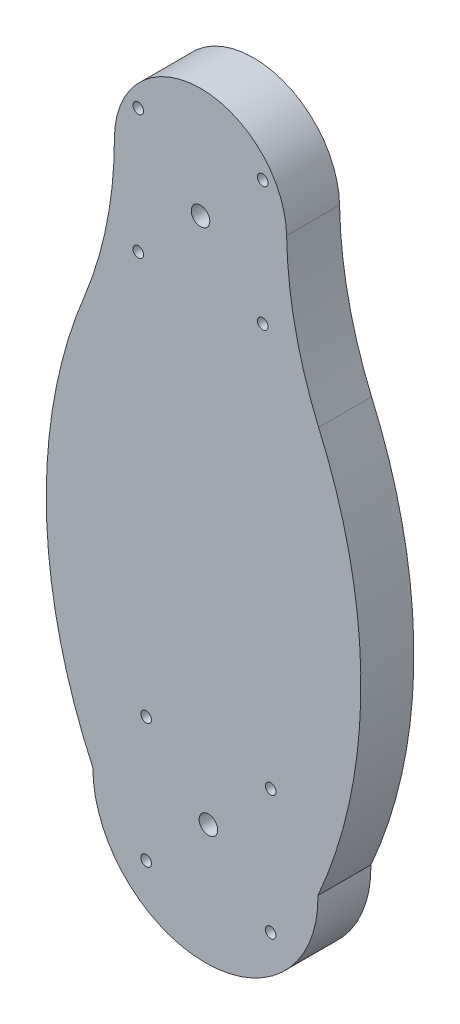
from build123d import *

# Parameters (mm, degrees)
BOSS_EXTRUDE1_DEPTH = 20
SKETCH2_R           = 3.5
SKETCH2_R_2         = 2
CUT_EXTRUDE6_DEPTH  = 208.432644896
SKETCH4_R           = 3.5
SKETCH4_R_2         = 2
CUT_EXTRUDE8_DEPTH  = 208.432644896


with BuildPart() as part:
    # Sketch1 → Boss-Extrude1 (new body)
    with BuildSketch(Plane.XY):
        with BuildLine():
            ThreePointArc((-42.5, -44.96942423), (0.373210889, -87.467785535), (42.493445347, -44.223031232))
            ThreePointArc((42.493445347, -44.223031232), (58.699206053, 32.335771546), (42.750578742, 108.948552787))
            ThreePointArc((42.750578742, 108.948552787), (33.960784088, 136.689765999), (30.650815647, 165.601346886))
            ThreePointArc((30.650815647, 165.601346886), (-2.129568534, 197.52932265), (-34.344171972, 165.03057577))
            ThreePointArc((-34.344171972, 165.03057577), (-37.145879301, 136.065323543), (-45.447121923, 108.174020751))
            ThreePointArc((-45.447121923, 108.174020751), (-60.04780144, 31.292962484), (-42.5, -44.96942423))
        make_face()
    extrude(amount=BOSS_EXTRUDE1_DEPTH)

    # Sketch2 → Cut-Extrude6 (cut, through all)
    with BuildSketch(Plane.XY.offset(20)):
        with Locations((-1.844171972, 155.798868961)):
            Circle(SKETCH2_R)
        with Locations((21.655828028, 179.298868961)):
            Circle(SKETCH2_R_2)
        with Locations((-25.344171972, 179.298868961)):
            Circle(SKETCH2_R_2)
        with Locations((21.655828028, 132.298868961)):
            Circle(SKETCH2_R_2)
        with Locations((-25.344171972, 132.298868961)):
            Circle(SKETCH2_R_2)
    extrude(amount=-CUT_EXTRUDE6_DEPTH, mode=Mode.SUBTRACT)

    # Sketch4 → Cut-Extrude8 (cut, through all)
    with BuildSketch(Plane.XY.offset(20)):
        with Locations((1.132601083, -41.747329739)):
            Circle(SKETCH4_R)
        with Locations((24.632601083, -18.247329739)):
            Circle(SKETCH4_R_2)
        with Locations((-22.367398917, -18.247329739)):
            Circle(SKETCH4_R_2)
        with Locations((24.632601083, -65.247329739)):
            Circle(SKETCH4_R_2)
        with Locations((-22.367398917, -65.247329739)):
            Circle(SKETCH4_R_2)
    extrude(amount=-CUT_EXTRUDE8_DEPTH, mode=Mode.SUBTRACT)


solid = part.part
